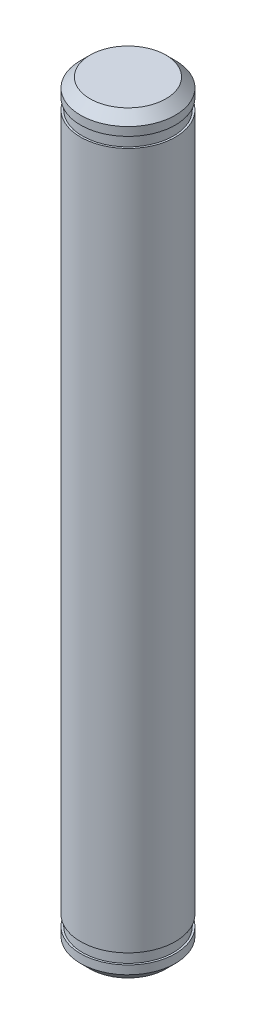
from build123d import *

# Parameters (mm, degrees)
CHAMFER_1_SIZE      = 1
CUT_EXTRUDE_START   = -3
SKETCH_2_R          = 5
SKETCH_2_R_2        = 4.8
CUT_EXTRUDE_1_DEPTH = 1.1


with BuildPart() as part:
    # 草图1 → 旋转1 (revolve)
    with BuildSketch(Plane.XY, mode=Mode.PRIVATE) as revolve_1_sk:
        Polygon((0, 39.745), (5, 39.745), (5, 29.00117383), (5, -29.00117383), (5, -39.745), (0, -39.745), align=None)
    revolve(revolve_1_sk.sketch.rotate(Axis((0, 39.745, 0), (0, -1, 0)), 90), axis=Axis((0, 39.745, 0), (0, -1, 0)))

    # 倒角1
    chamfer_1_edges = [part.edges().sort_by_distance(p)[0] for p in [
        (0, -39.745, -5),
        (0, 39.745, -5),
    ]]
    chamfer(chamfer_1_edges, length=CHAMFER_1_SIZE)

    # 草图2 → 切除-拉伸1 (cut)
    with BuildSketch(Plane(origin=(0, 39.745, 0), x_dir=(1, 0, 0), z_dir=(0, 1, 0)).offset(CUT_EXTRUDE_START)):
        with Locations(Location((0, 0, 0), (0, 0, 180))):
            Circle(SKETCH_2_R)
        with Locations(Location((0, 0, 0), (0, 0, 180))):
            Circle(SKETCH_2_R_2, mode=Mode.SUBTRACT)
    cut_extrude_1 = extrude(amount=CUT_EXTRUDE_1_DEPTH, mode=Mode.SUBTRACT)

    # 镜向1: 切除-拉伸1 across plane
    add(cut_extrude_1.mirror(Plane.ZX), mode=Mode.SUBTRACT)


solid = part.part
